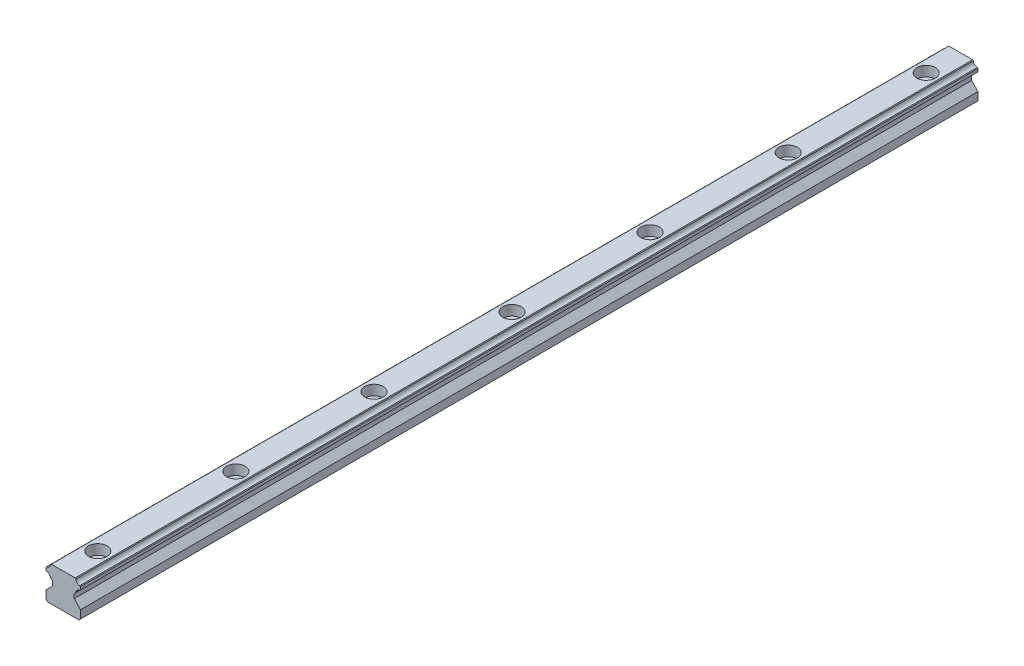
from build123d import *

# Parameters (mm, degrees)
BOSS_EXTRUDE1_DEPTH                                 = 390
CBORE_FOR_M4_HEX_SOCKET_HEAD_CAP_SCREW3_D           = 4.5
CBORE_FOR_M4_HEX_SOCKET_HEAD_CAP_SCREW3_CBORE_D     = 8
CBORE_FOR_M4_HEX_SOCKET_HEAD_CAP_SCREW3_CBORE_DEPTH = 4.4


with BuildPart() as part:
    # esboco-convertido → Boss-Extrude1 (new body)
    with BuildSketch(Plane.XY):
        with BuildLine():
            Line((-5.17, 15), (-5.45, 14.72))
            ThreePointArc((-5.45, 14.72), (-6.002972259, 13.601894134), (-7.15, 13.111724361))
            Line((-7.15, 13.111724361), (-7.43, 12.831724361))
            Line((-7.43, 12.831724361), (-7.43, 11.562021626))
            Line((-7.43, 11.562021626), (-7.15, 11.282021626))
            ThreePointArc((-7.15, 11.282021626), (-5.99259296, 10.781953917), (-5.447208, 9.645198))
            Line((-5.447208, 9.645198), (-4.73, 8.92799))
            Line((-4.73, 8.92799), (-4.73, 6.97))
            Line((-4.73, 6.97), (-7.5, 4.2))
            Line((-7.5, 4.2), (-7.5, 0.7))
            Line((-7.5, 0.7), (-6.8, 0))
            Line((-6.8, 0), (6.8, 0))
            Line((6.8, 0), (7.5, 0.7))
            Line((7.5, 0.7), (7.5, 4.2))
            Line((7.5, 4.2), (4.73, 6.97))
            Line((4.73, 6.97), (4.73, 8.92799))
            Line((4.73, 8.92799), (5.447208, 9.645198))
            ThreePointArc((5.447208, 9.645198), (5.99259296, 10.781953917), (7.15, 11.282021626))
            Line((7.15, 11.282021626), (7.43, 11.562021626))
            Line((7.43, 11.562021626), (7.43, 12.831724361))
            Line((7.43, 12.831724361), (7.15, 13.111724361))
            ThreePointArc((7.15, 13.111724361), (6.002972259, 13.601894134), (5.45, 14.72))
            Line((5.45, 14.72), (5.17, 15))
            Line((5.17, 15), (-5.17, 15))
        make_face()
    extrude(amount=BOSS_EXTRUDE1_DEPTH)

    # CBORE for M4 Hex Socket Head Cap Screw3 (through all)
    with Locations(Plane(origin=(0, 15, 0), x_dir=(1, 0, 0), z_dir=(0, 1, 0))):
        with Locations((0, -15), (0, -375), (0, -315), (0, -255), (0, -195), (0, -135), (0, -75)):
            CounterBoreHole(CBORE_FOR_M4_HEX_SOCKET_HEAD_CAP_SCREW3_D / 2, CBORE_FOR_M4_HEX_SOCKET_HEAD_CAP_SCREW3_CBORE_D / 2, CBORE_FOR_M4_HEX_SOCKET_HEAD_CAP_SCREW3_CBORE_DEPTH)


solid = part.part
